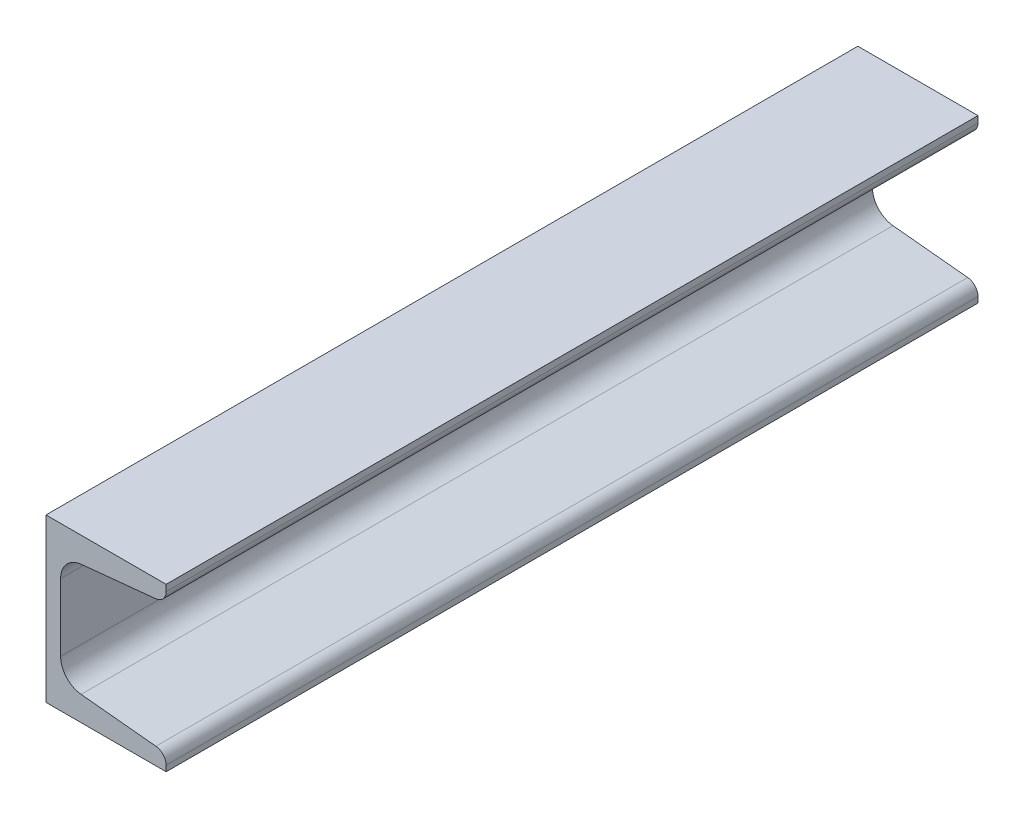
from build123d import *

# Parameters (mm, degrees)
EXTRUDE_1_DEPTH = 250


with BuildPart() as part:
    # 草图1 → 凸台-拉伸1 (new body)
    with BuildSketch(Plane.XY):
        with BuildLine():
            Line((0, 0), (0, 50))
            Line((0, 50), (37, 50))
            Line((37, 50), (37, 48.040012398))
            ThreePointArc((37, 48.040012398), (36.095083867, 45.691493776), (33.848263017, 44.557382233))
            Line((33.848263017, 44.557382233), (10.803473967, 42.252903328))
            ThreePointArc((10.803473967, 42.252903328), (6.309832265, 39.984680242), (4.5, 35.287642996))
            Line((4.5, 35.287642996), (4.5, 14.509912935))
            ThreePointArc((4.5, 14.509912935), (6.309832265, 9.812875689), (10.803473967, 7.544652603))
            Line((10.803473967, 7.544652603), (33.848263017, 5.240173698))
            ThreePointArc((33.848263017, 5.240173698), (36.095083867, 4.106062155), (37, 1.757543533))
            Line((37, 1.757543533), (37, 0))
            Line((37, 0), (0, 0))
        make_face()
    extrude(amount=EXTRUDE_1_DEPTH)


solid = part.part
